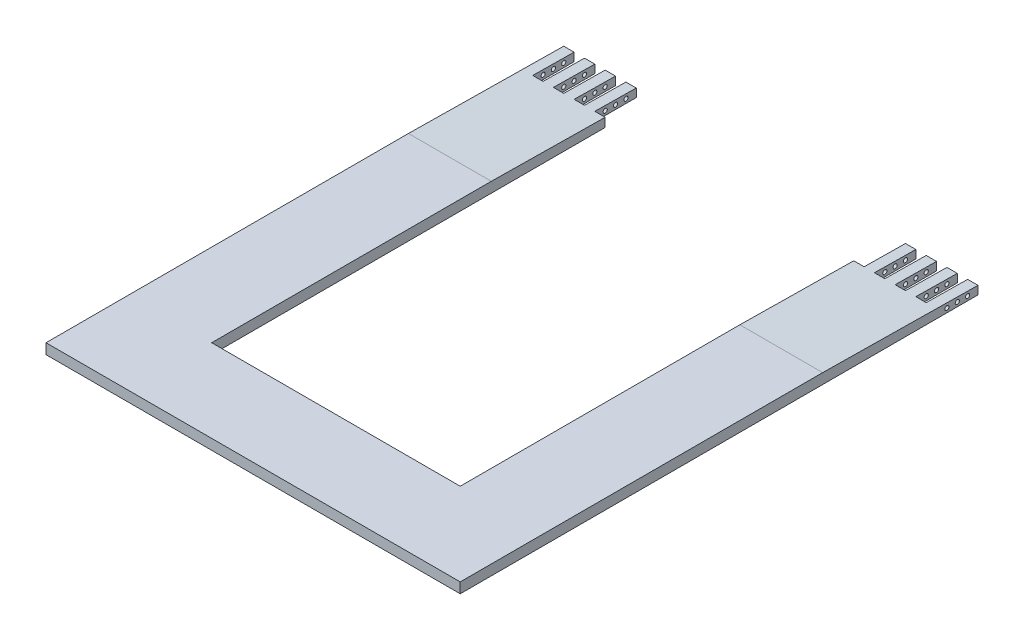
from build123d import *

# Parameters (mm, degrees)
SKETCH_1_W          = 40
SKETCH_1_H          = 435
SKETCH_1_H_2        = 40
SKETCH_1_W_2        = 120
EXTRUDE_1_DEPTH     = 5
CUT_EXTRUDE_2_DEPTH = 498.041245773
SKETCH_3_W          = 5
SKETCH_3_H          = 20
CUT_EXTRUDE_3_DEPTH = 466.886252212
SKETCH_4_R          = 1
CUT_EXTRUDE_4_DEPTH = 305.836021494


with BuildPart() as part:
    # 草图1 → 凸台-拉伸1 (new body)
    with BuildSketch(Plane(origin=(0, 0, 0), x_dir=(1, 0, 0), z_dir=(0, 1, 0))):
        with Locations((-80, 237.5)):
            Rectangle(SKETCH_1_W, SKETCH_1_H)
        with Locations((-80, 0)):
            Rectangle(SKETCH_1_W, SKETCH_1_H_2)
        Rectangle(SKETCH_1_W_2, SKETCH_1_H_2)
        with Locations((80, 0)):
            Rectangle(SKETCH_1_W, SKETCH_1_H_2)
        with Locations((80, 237.5)):
            Rectangle(SKETCH_1_W, SKETCH_1_H)
    extrude(amount=EXTRUDE_1_DEPTH)

    # 草图2 → 切除-拉伸2 (cut, through all)
    with BuildSketch(Plane(origin=(100, 0, 0), x_dir=(0, 0, -1), z_dir=(1, 0, 0))):
        Polygon((155, 5), (455, 1), (455, 5), align=None)
    extrude(amount=-CUT_EXTRUDE_2_DEPTH, mode=Mode.SUBTRACT)

    # 草图3 → 切除-拉伸3 (cut, through all)
    with BuildSketch(Plane(origin=(0, 5, 0), x_dir=(1, 0, 0), z_dir=(0, 1, 0))):
        Polygon((-100, 455), (-100, 230), (-95, 230), (-90, 230), (-85, 230), (-80, 230), (-75, 230), (-70, 230), (-65, 230), (-60, 230), (60, 230), (65, 230), (70, 230), (75, 230), (80, 230), (85, 230), (90, 230), (95, 230), (100, 230), (100, 455), align=None)
        with Locations((-92.5, 220)):
            Rectangle(SKETCH_3_W, SKETCH_3_H)
        with Locations((-82.5, 220)):
            Rectangle(SKETCH_3_W, SKETCH_3_H)
        with Locations((-72.5, 220)):
            Rectangle(SKETCH_3_W, SKETCH_3_H)
        with Locations((-62.5, 220)):
            Rectangle(SKETCH_3_W, SKETCH_3_H)
        with Locations((62.5, 220)):
            Rectangle(SKETCH_3_W, SKETCH_3_H)
        with Locations((72.5, 220)):
            Rectangle(SKETCH_3_W, SKETCH_3_H)
        with Locations((82.5, 220)):
            Rectangle(SKETCH_3_W, SKETCH_3_H)
        with Locations((92.5, 220)):
            Rectangle(SKETCH_3_W, SKETCH_3_H)
    extrude(amount=-CUT_EXTRUDE_3_DEPTH, mode=Mode.SUBTRACT)

    # 草图4 → 切除-拉伸4 (cut, through all)
    with BuildSketch(Plane(origin=(100, 0, 0), x_dir=(0, 0, -1), z_dir=(1, 0, 0))):
        with Locations((225, 2)):
            Circle(SKETCH_4_R)
        with Locations((220, 2)):
            Circle(SKETCH_4_R)
        with Locations((215, 2)):
            Circle(SKETCH_4_R)
    extrude(amount=-CUT_EXTRUDE_4_DEPTH, mode=Mode.SUBTRACT)


solid = part.part
